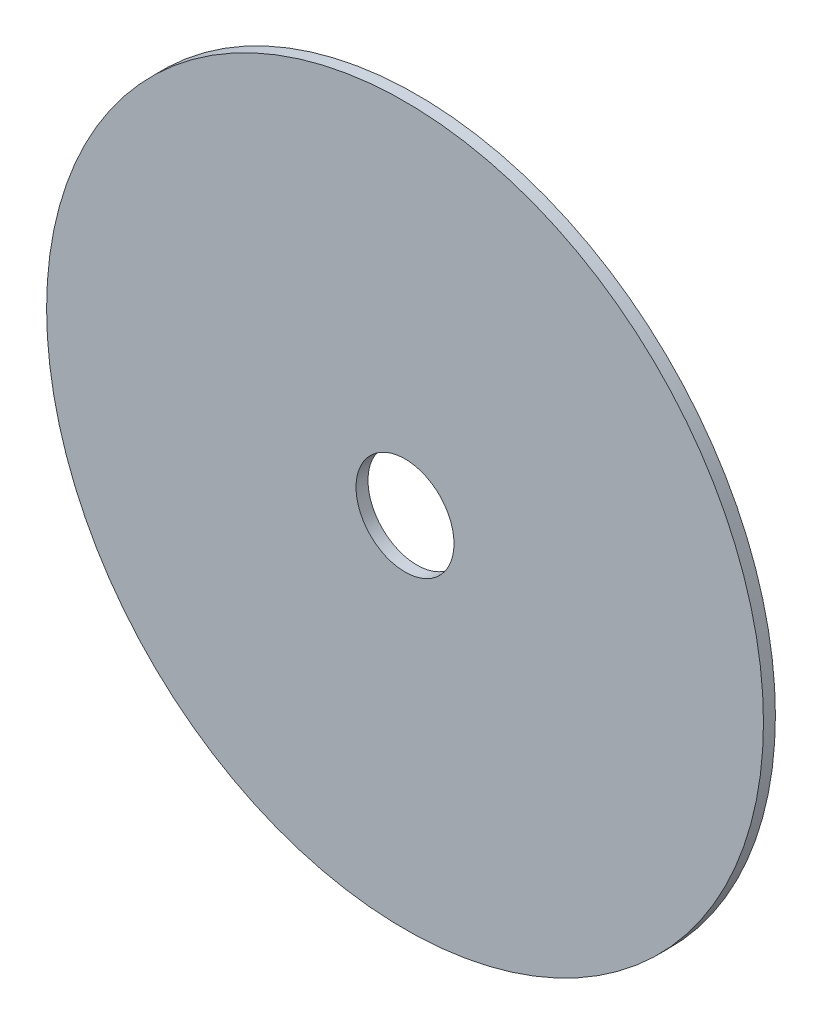
from build123d import *

# Parameters (mm, degrees)
SKETCH_1_R      = 30
SKETCH_1_R_2    = 4.1
EXTRUDE_1_DEPTH = 1


with BuildPart() as part:
    # 草图1 → 凸台-拉伸1 (new body)
    with BuildSketch(Plane.XY):
        Circle(SKETCH_1_R)
        Circle(SKETCH_1_R_2, mode=Mode.SUBTRACT)
    extrude(amount=EXTRUDE_1_DEPTH)


solid = part.part
